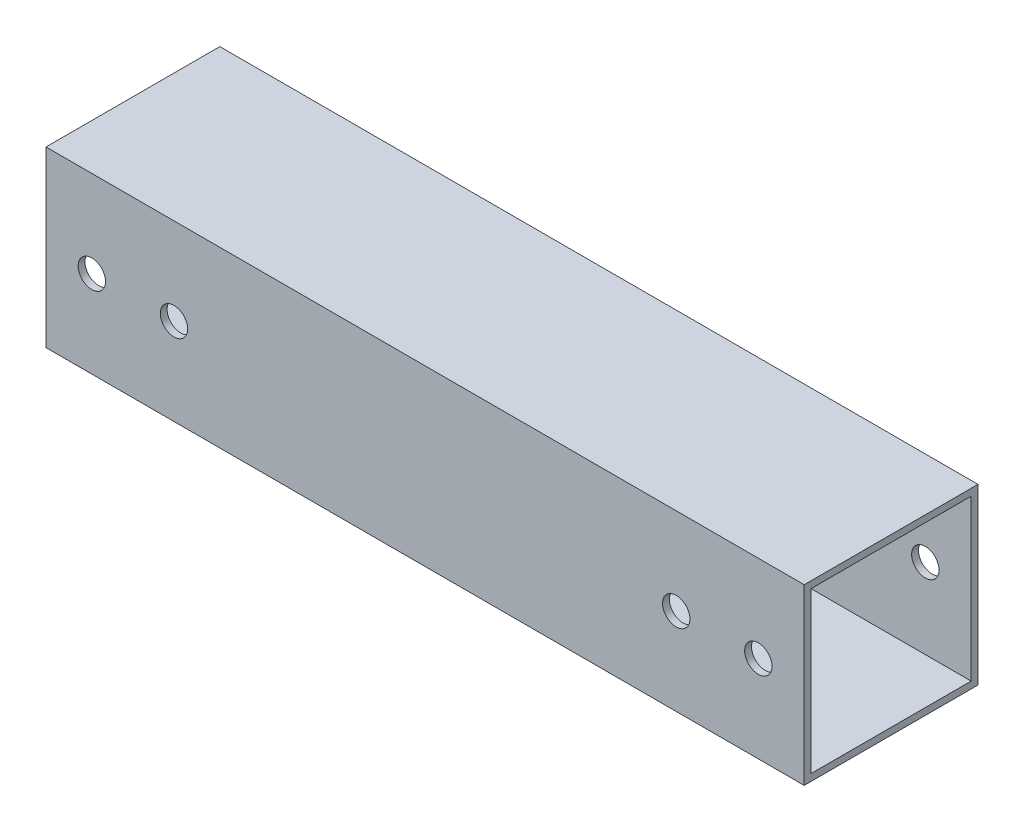
from build123d import *

# Parameters (mm, degrees)
SKETCH1_W               = 25.4
SKETCH1_H               = 25.4
SKETCH1_W_2             = 23.4
SKETCH1_H_2             = 23.4
BOSS_EXTRUDE1_DEPTH     = 110.8
CUT_EXTRUDE1_DEPTH      = 115.38133589
CUT_EXTRUDE1_DEPTH_BACK = 115.38133589
SKETCH2_R               = 2


with BuildPart() as part:
    # Sketch1 → Boss-Extrude1 (new body)
    with BuildSketch(Plane(origin=(0, 0, 0), x_dir=(0, 0, -1), z_dir=(1, 0, 0))):
        Rectangle(SKETCH1_W, SKETCH1_H)
        Rectangle(SKETCH1_W_2, SKETCH1_H_2, mode=Mode.SUBTRACT)
    extrude(amount=BOSS_EXTRUDE1_DEPTH)

    # Sketch2 → Cut-Extrude1 (cut, two sides: drawn at the far end of the back side and taken through both)
    with BuildSketch(Plane.XY.offset(12.7).offset(-CUT_EXTRUDE1_DEPTH_BACK)):
        with Locations(Location((92.1, 0, 0), (0, 0, 180))):
            Circle(SKETCH2_R)
        with Locations(Location((104.1, 0, 0), (0, 0, 180))):
            Circle(SKETCH2_R)
        with Locations(Location((6.7, 0, 0), (0, 0, 180))):
            Circle(SKETCH2_R)
        with Locations(Location((18.7, 0, 0), (0, 0, 180))):
            Circle(SKETCH2_R)
    extrude(amount=CUT_EXTRUDE1_DEPTH + CUT_EXTRUDE1_DEPTH_BACK, mode=Mode.SUBTRACT)


solid = part.part
